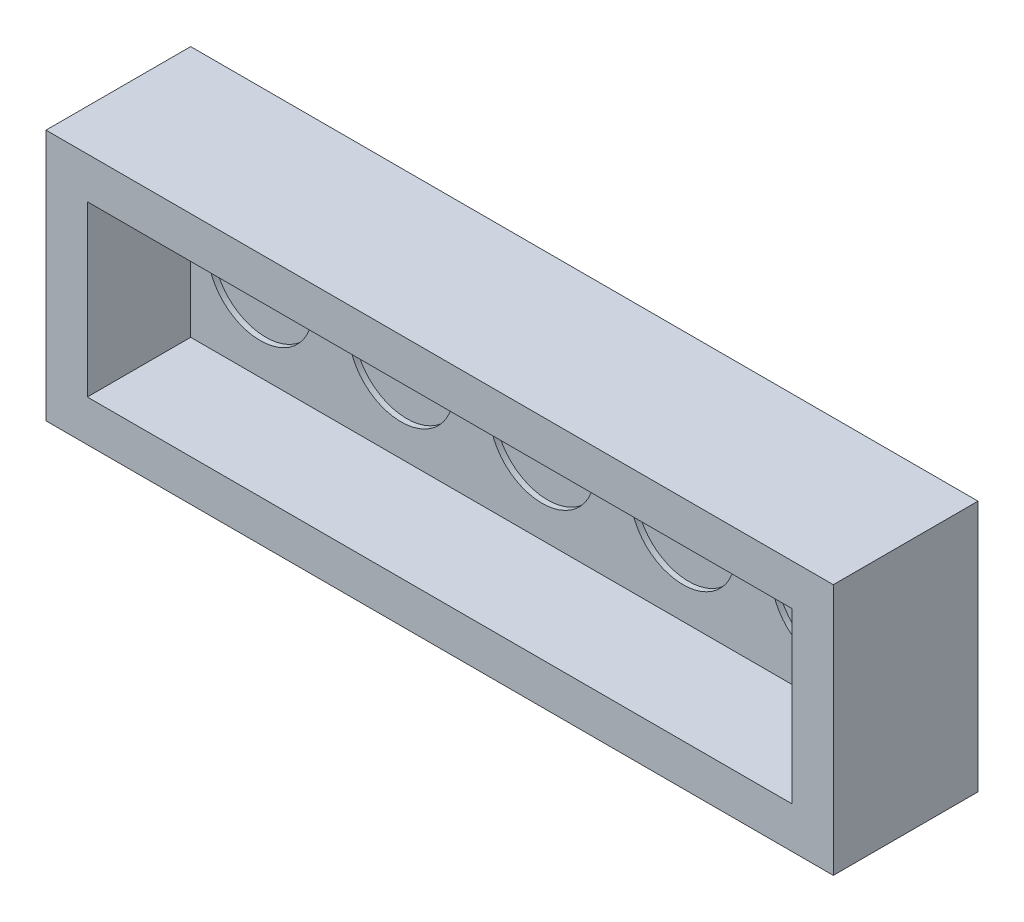
from build123d import *

# Parameters (mm, degrees)
ESQUISSE1_W             = 419
ESQUISSE1_H             = 134
BOSS_EXTRU_1_DEPTH      = 22
ESQUISSE3_W             = 419
ESQUISSE3_H             = 134
ESQUISSE3_W_2           = 375
ESQUISSE3_H_2           = 90
BOSS_EXTRU_2_DEPTH      = 55
ESQUISSE4_R             = 28
ENL_V_MAT_EXTRU_1_DEPTH = 3


with BuildPart() as part:
    # Esquisse1 → Boss.-Extru.1 (new body)
    with BuildSketch(Plane.XY):
        with Locations((209.5, -67)):
            Rectangle(ESQUISSE1_W, ESQUISSE1_H)
    extrude(amount=BOSS_EXTRU_1_DEPTH)

    # Esquisse3 → Boss.-Extru.2 (add)
    with BuildSketch(Plane.XY.offset(22)):
        with Locations((209.5, -67)):
            Rectangle(ESQUISSE3_W, ESQUISSE3_H)
        with Locations((209.5, -67)):
            Rectangle(ESQUISSE3_W_2, ESQUISSE3_H_2, mode=Mode.SUBTRACT)
    extrude(amount=BOSS_EXTRU_2_DEPTH)

    # Esquisse4 → Enlèv. mat.-Extru.1 (cut)
    with BuildSketch(Plane.XY.offset(22)):
        with Locations((59, -67)):
            Circle(ESQUISSE4_R)
        with Locations((134, -67)):
            Circle(ESQUISSE4_R)
        with Locations((209, -67)):
            Circle(ESQUISSE4_R)
        with Locations((284, -67)):
            Circle(ESQUISSE4_R)
        with Locations((359, -67)):
            Circle(ESQUISSE4_R)
    extrude(amount=-ENL_V_MAT_EXTRU_1_DEPTH, mode=Mode.SUBTRACT)


solid = part.part
